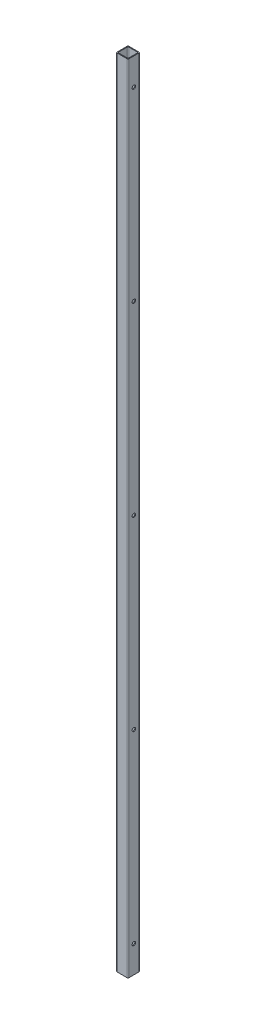
from build123d import *

# Parameters (mm, degrees)
SKETCH1_W                  = 19.304
SKETCH1_H                  = 19.304
SKETCH1_W_2                = 16.764
SKETCH1_H_2                = 16.764
BOSS_EXTRUDE1_DEPTH        = 1308.1
FILLET1_R                  = 1.27
F_1_0_228_DIAMETER_HOLE1_D = 5.7912


with BuildPart() as part:
    # Sketch1 → Boss-Extrude1 (new body)
    with BuildSketch(Plane(origin=(0, 0, 0), x_dir=(1, 0, 0), z_dir=(0, 1, 0))):
        Rectangle(SKETCH1_W, SKETCH1_H)
        Rectangle(SKETCH1_W_2, SKETCH1_H_2, mode=Mode.SUBTRACT)
    extrude(amount=BOSS_EXTRUDE1_DEPTH)

    # Fillet1
    fillet1_edges = [part.edges().sort_by_distance(p)[0] for p in [
        (-8.382, 654.05, 8.382),
        (8.382, 654.05, 8.382),
        (8.382, 654.05, -8.382),
        (-8.382, 654.05, -8.382),
        (9.652, 654.05, 9.652),
        (-9.652, 654.05, 9.652),
        (-9.652, 654.05, -9.652),
        (9.652, 654.05, -9.652),
    ]]
    fillet(fillet1_edges, radius=FILLET1_R)

    # #1 (0.228) Diameter Hole1 (through all)
    with Locations(Plane(origin=(9.652, 0, 0), x_dir=(0, 0, -1), z_dir=(1, 0, 0))):
        with Locations((0, 44.45), (0, 1263.65), (0, 958.85), (0, 654.05), (0, 349.25)):
            Hole(F_1_0_228_DIAMETER_HOLE1_D / 2)


solid = part.part
